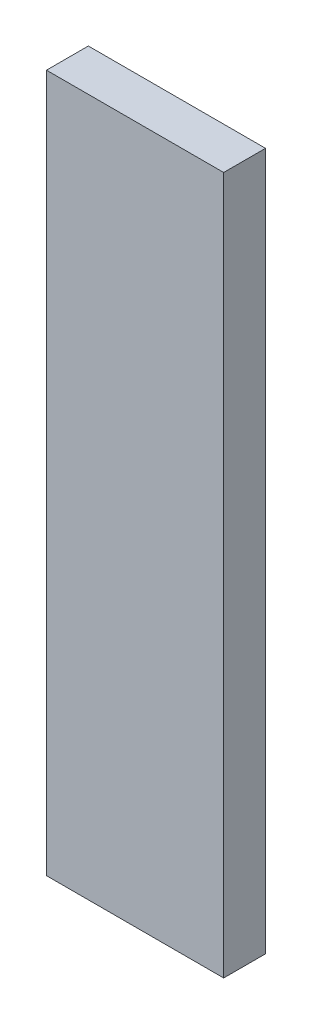
from build123d import *

# Parameters (mm, degrees)
SKETCH1_W           = 6.35
SKETCH1_H           = 25
BOSS_EXTRUDE1_DEPTH = 1.5


with BuildPart() as part:
    # Sketch1 → Boss-Extrude1 (new body)
    with BuildSketch(Plane.XY):
        Rectangle(SKETCH1_W, SKETCH1_H)
    extrude(amount=BOSS_EXTRUDE1_DEPTH)


solid = part.part
